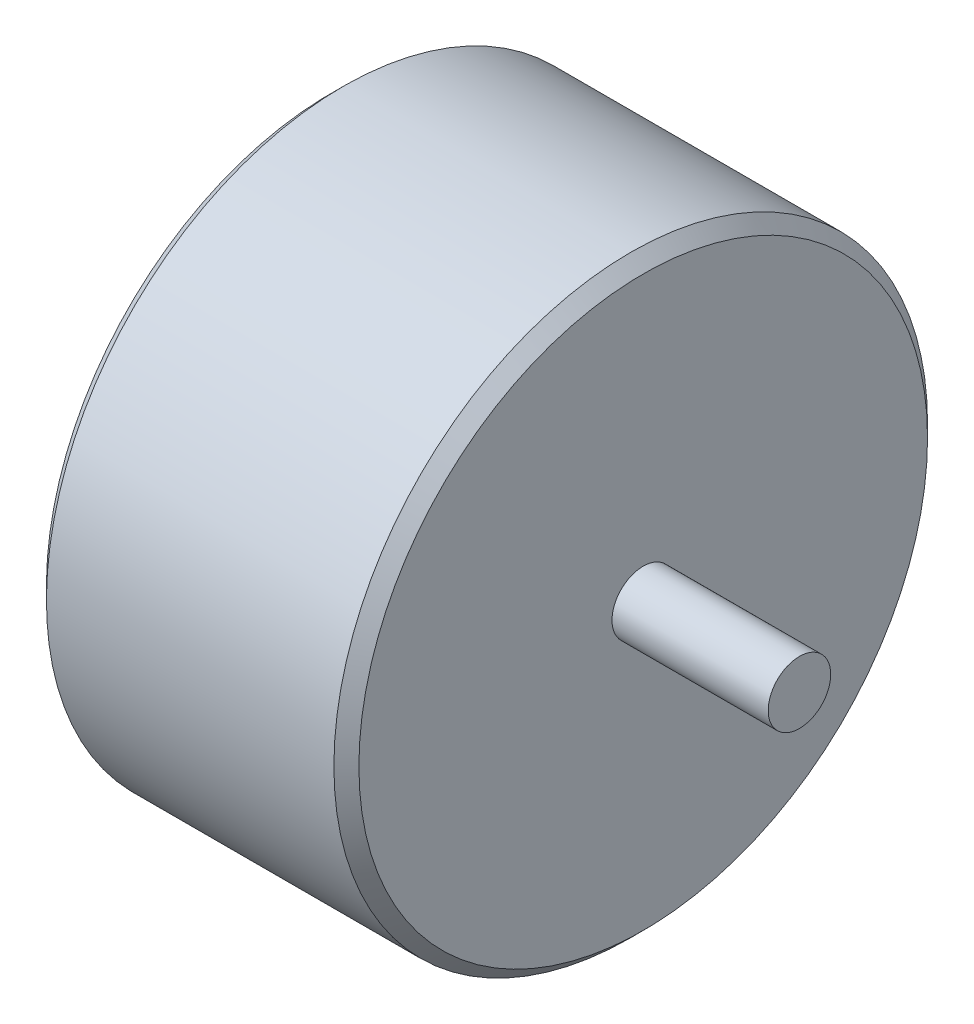
from build123d import *

# Parameters (mm, degrees)
SKETCH1_R           = 12.065
BOSS_EXTRUDE1_DEPTH = 12.7
SKETCH2_R           = 1.27
BOSS_EXTRUDE2_DEPTH = 6.35
SKETCH4_W           = 5.04217838
SKETCH4_H           = 7.772020178
CUT_EXTRUDE1_DEPTH  = 3.81
CHAMFER1_SIZE       = 0.508


with BuildPart() as part:
    # Sketch1 → Boss-Extrude1 (new body)
    with BuildSketch(Plane(origin=(0, 0, 0), x_dir=(0, 0, -1), z_dir=(1, 0, 0))):
        Circle(SKETCH1_R)
    extrude(amount=BOSS_EXTRUDE1_DEPTH)

    # Sketch2 → Boss-Extrude2 (add)
    with BuildSketch(Plane(origin=(12.7, 0, 0), x_dir=(0, 0, -1), z_dir=(1, 0, 0))):
        Circle(SKETCH2_R)
    extrude(amount=BOSS_EXTRUDE2_DEPTH)

    # Sketch4 → Cut-Extrude1 (cut)
    with BuildSketch(Plane.ZY):
        with Locations((-11.192351372, 0.27298418)):
            Rectangle(SKETCH4_W, SKETCH4_H)
    extrude(amount=-CUT_EXTRUDE1_DEPTH, mode=Mode.SUBTRACT)

    # Chamfer1
    chamfer1_edges = [part.edges().sort_by_distance(p)[0] for p in [
        (0, -0.288360149, 12.061553525),
        (12.7, 0, 12.065),
    ]]
    chamfer(chamfer1_edges, length=CHAMFER1_SIZE)


solid = part.part
